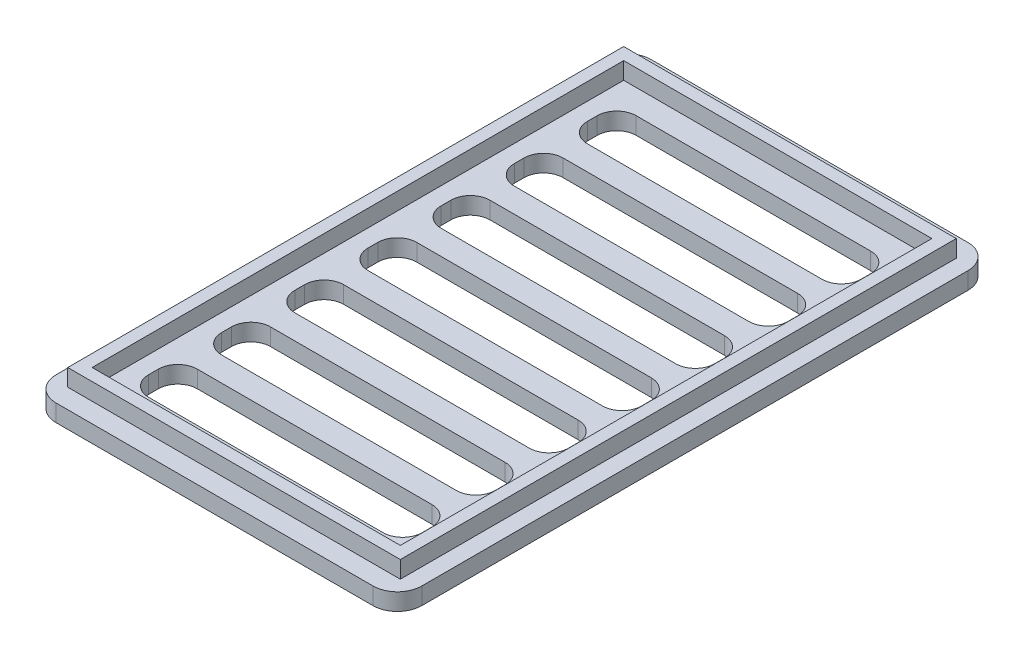
from build123d import *

# Parameters (mm, degrees)
SKETCH1_W           = 37.5
SKETCH1_H           = 61
BOSS_EXTRUDE1_DEPTH = 1.75
SKETCH2_W           = 34.1
SKETCH2_H           = 57
BOSS_EXTRUDE2_DEPTH = 1.75
SKETCH3_W           = 31.6
SKETCH3_H           = 54.5
CUT_EXTRUDE1_DEPTH  = 1.75
CUT_EXTRUDE3_DEPTH  = 1.75
FILLET1_R           = 2.5
FILLET2_R           = 2.5
FILLET3_R           = 2.5
FILLET4_R           = 2.5


with BuildPart() as part:
    # Sketch1 → Boss-Extrude1 (new body)
    with BuildSketch(Plane(origin=(0, 0, 0), x_dir=(1, 0, 0), z_dir=(0, 1, 0))):
        with Locations((-156.892564619, -93.568616843)):
            Rectangle(SKETCH1_W, SKETCH1_H)
    extrude(amount=BOSS_EXTRUDE1_DEPTH)

    # Sketch2 → Boss-Extrude2 (add)
    with BuildSketch(Plane(origin=(0, 1.75, 0), x_dir=(1, 0, 0), z_dir=(0, 1, 0))):
        with Locations((-156.892564619, -93.568616843)):
            Rectangle(SKETCH2_W, SKETCH2_H)
    extrude(amount=BOSS_EXTRUDE2_DEPTH)

    # Sketch3 → Cut-Extrude1 (cut)
    with BuildSketch(Plane(origin=(0, 3.5, 0), x_dir=(1, 0, 0), z_dir=(0, 1, 0))):
        with Locations((-156.892564619, -93.568616843)):
            Rectangle(SKETCH3_W, SKETCH3_H)
    extrude(amount=-CUT_EXTRUDE1_DEPTH, mode=Mode.SUBTRACT)

    # Sketch4 → Cut-Extrude3 (cut)
    with BuildSketch(Plane(origin=(0, 1.75, 0), x_dir=(1, 0, 0), z_dir=(0, 1, 0))):
        with BuildLine():
            Line((-168.906040513, -118.818616843), (-144.860961832, -118.818616843))
            ThreePointArc((-144.860961832, -118.818616843), (-143.446748269, -118.232830406), (-142.860961832, -116.818616843))
            Line((-142.860961832, -116.818616843), (-142.860961832, -115.818616843))
            ThreePointArc((-142.860961832, -115.818616843), (-143.446748269, -114.404403281), (-144.860961832, -113.818616843))
            Line((-144.860961832, -113.818616843), (-168.906040513, -113.818616843))
            ThreePointArc((-168.906040513, -113.818616843), (-170.320254075, -114.404403281), (-170.906040513, -115.818616843))
            Line((-170.906040513, -115.818616843), (-170.906040513, -116.818616843))
            ThreePointArc((-170.906040513, -116.818616843), (-170.320254075, -118.232830406), (-168.906040513, -118.818616843))
        make_face()
        with BuildLine():
            Line((-168.906040513, -103.818616843), (-144.860961832, -103.818616843))
            ThreePointArc((-144.860961832, -103.818616843), (-143.446748269, -103.232830406), (-142.860961832, -101.818616843))
            Line((-142.860961832, -101.818616843), (-142.860961832, -100.818616843))
            ThreePointArc((-142.860961832, -100.818616843), (-143.446748269, -99.404403281), (-144.860961832, -98.818616843))
            Line((-144.860961832, -98.818616843), (-168.906040513, -98.818616843))
            ThreePointArc((-168.906040513, -98.818616843), (-170.320254075, -99.404403281), (-170.906040513, -100.818616843))
            Line((-170.906040513, -100.818616843), (-170.906040513, -101.818616843))
            ThreePointArc((-170.906040513, -101.818616843), (-170.320254075, -103.232830406), (-168.906040513, -103.818616843))
        make_face()
        with BuildLine():
            Line((-168.906040513, -96.318616843), (-144.860961832, -96.318616843))
            ThreePointArc((-144.860961832, -96.318616843), (-143.446748269, -95.732830406), (-142.860961832, -94.318616843))
            Line((-142.860961832, -94.318616843), (-142.860961832, -93.318616843))
            ThreePointArc((-142.860961832, -93.318616843), (-143.446748269, -91.904403281), (-144.860961832, -91.318616843))
            Line((-144.860961832, -91.318616843), (-168.906040513, -91.318616843))
            ThreePointArc((-168.906040513, -91.318616843), (-170.320254075, -91.904403281), (-170.906040513, -93.318616843))
            Line((-170.906040513, -93.318616843), (-170.906040513, -94.318616843))
            ThreePointArc((-170.906040513, -94.318616843), (-170.320254075, -95.732830406), (-168.906040513, -96.318616843))
        make_face()
        with BuildLine():
            Line((-168.906040513, -81.318616843), (-144.860961832, -81.318616843))
            ThreePointArc((-144.860961832, -81.318616843), (-143.446748269, -80.732830406), (-142.860961832, -79.318616843))
            Line((-142.860961832, -79.318616843), (-142.860961832, -78.318616843))
            ThreePointArc((-142.860961832, -78.318616843), (-143.446748269, -76.904403281), (-144.860961832, -76.318616843))
            Line((-144.860961832, -76.318616843), (-168.906040513, -76.318616843))
            ThreePointArc((-168.906040513, -76.318616843), (-170.320254075, -76.904403281), (-170.906040513, -78.318616843))
            Line((-170.906040513, -78.318616843), (-170.906040513, -79.318616843))
            ThreePointArc((-170.906040513, -79.318616843), (-170.320254075, -80.732830406), (-168.906040513, -81.318616843))
        make_face()
        with BuildLine():
            Line((-168.906040513, -111.318616843), (-144.860961832, -111.318616843))
            ThreePointArc((-144.860961832, -111.318616843), (-143.446748269, -110.732830406), (-142.860961832, -109.318616843))
            Line((-142.860961832, -109.318616843), (-142.860961832, -108.318616843))
            ThreePointArc((-142.860961832, -108.318616843), (-143.446748269, -106.904403281), (-144.860961832, -106.318616843))
            Line((-144.860961832, -106.318616843), (-168.906040513, -106.318616843))
            ThreePointArc((-168.906040513, -106.318616843), (-170.320254075, -106.904403281), (-170.906040513, -108.318616843))
            Line((-170.906040513, -108.318616843), (-170.906040513, -109.318616843))
            ThreePointArc((-170.906040513, -109.318616843), (-170.320254075, -110.732830406), (-168.906040513, -111.318616843))
        make_face()
        with BuildLine():
            Line((-168.906040513, -88.818616843), (-144.860961832, -88.818616843))
            ThreePointArc((-144.860961832, -88.818616843), (-143.446748269, -88.232830406), (-142.860961832, -86.818616843))
            Line((-142.860961832, -86.818616843), (-142.860961832, -85.818616843))
            ThreePointArc((-142.860961832, -85.818616843), (-143.446748269, -84.404403281), (-144.860961832, -83.818616843))
            Line((-144.860961832, -83.818616843), (-168.906040513, -83.818616843))
            ThreePointArc((-168.906040513, -83.818616843), (-170.320254075, -84.404403281), (-170.906040513, -85.818616843))
            Line((-170.906040513, -85.818616843), (-170.906040513, -86.818616843))
            ThreePointArc((-170.906040513, -86.818616843), (-170.320254075, -88.232830406), (-168.906040513, -88.818616843))
        make_face()
        with BuildLine():
            Line((-168.906040513, -73.818616843), (-144.860961832, -73.818616843))
            ThreePointArc((-144.860961832, -73.818616843), (-143.446748269, -73.232830406), (-142.860961832, -71.818616843))
            Line((-142.860961832, -71.818616843), (-142.860961832, -70.818616843))
            ThreePointArc((-142.860961832, -70.818616843), (-143.446748269, -69.404403281), (-144.860961832, -68.818616843))
            Line((-144.860961832, -68.818616843), (-168.906040513, -68.818616843))
            ThreePointArc((-168.906040513, -68.818616843), (-170.320254075, -69.404403281), (-170.906040513, -70.818616843))
            Line((-170.906040513, -70.818616843), (-170.906040513, -71.818616843))
            ThreePointArc((-170.906040513, -71.818616843), (-170.320254075, -73.232830406), (-168.906040513, -73.818616843))
        make_face()
    extrude(amount=-CUT_EXTRUDE3_DEPTH, mode=Mode.SUBTRACT)

    # Fillet1
    fillet1_edges = [part.edges().sort_by_distance(p)[0] for p in [
        (-138.142564619, 0.875, 63.068616843),
    ]]
    fillet(fillet1_edges, radius=FILLET1_R)

    # Fillet2
    fillet2_edges = [part.edges().sort_by_distance(p)[0] for p in [
        (-175.642564619, 0.875, 63.068616843),
    ]]
    fillet(fillet2_edges, radius=FILLET2_R)

    # Fillet3
    fillet3_edges = [part.edges().sort_by_distance(p)[0] for p in [
        (-175.642564619, 0.875, 124.068616843),
    ]]
    fillet(fillet3_edges, radius=FILLET3_R)

    # Fillet4
    fillet4_edges = [part.edges().sort_by_distance(p)[0] for p in [
        (-138.142564619, 0.875, 124.068616843),
    ]]
    fillet(fillet4_edges, radius=FILLET4_R)


solid = part.part
